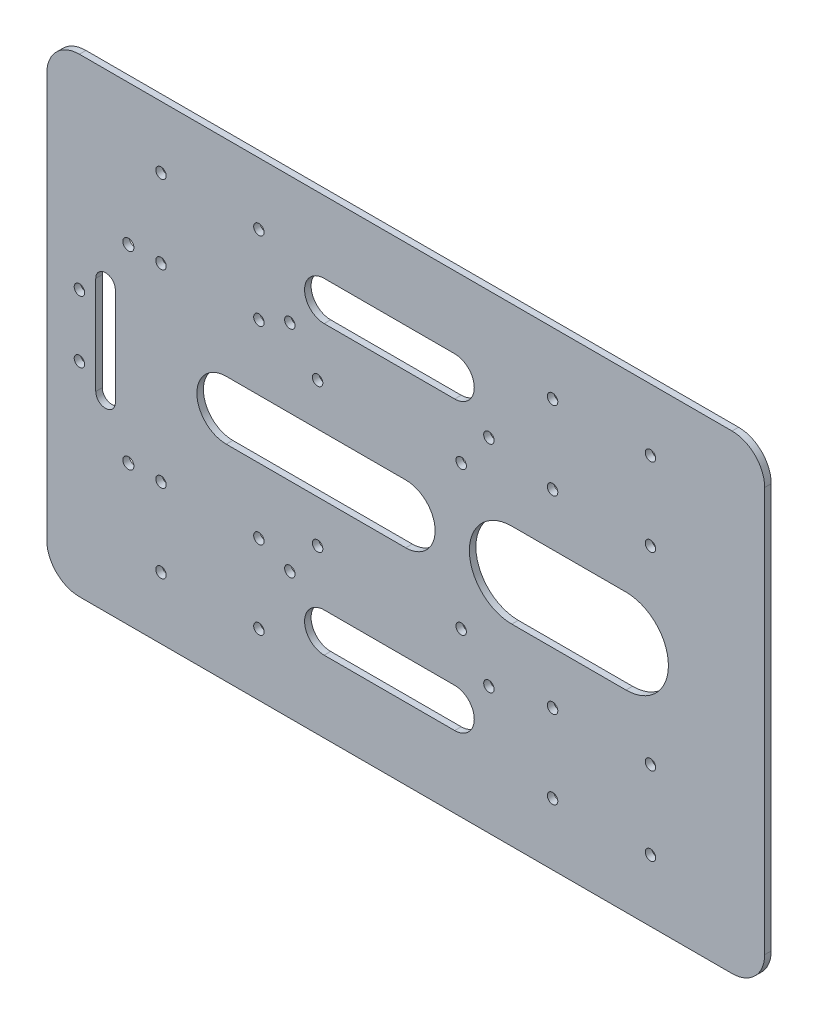
from build123d import *

# Parameters (mm, degrees)
SKETCH_1_W          = 220
SKETCH_1_H          = 144
SKETCH_1_R          = 1.6
SKETCH_1_R_2        = 1.6002032
EXTRUDE_1_DEPTH     = 2
CUT_EXTRUDE_1_DEPTH = 10
FILLET_1_R          = 10
CUT_EXTRUDE_2_DEPTH = 10
CUT_EXTRUDE_3_DEPTH = 10
SKETCH_8_R          = 1.6
CUT_EXTRUDE_4_DEPTH = 10
SKETCH_9_R          = 1.7
CUT_EXTRUDE_5_DEPTH = 10


with BuildPart() as part:
    # 草图1 → 凸台-拉伸1 (new body)
    with BuildSketch(Plane.XY):
        with Locations((60, -41.5)):
            Rectangle(SKETCH_1_W, SKETCH_1_H)
        with Locations((135, 11.5)):
            Circle(SKETCH_1_R, mode=Mode.SUBTRACT)
        with Locations((135, -12.5)):
            Circle(SKETCH_1_R, mode=Mode.SUBTRACT)
        with Locations((105, 11.5)):
            Circle(SKETCH_1_R, mode=Mode.SUBTRACT)
        with Locations((105, -12.5)):
            Circle(SKETCH_1_R, mode=Mode.SUBTRACT)
        with Locations((135, -70.5)):
            Circle(SKETCH_1_R, mode=Mode.SUBTRACT)
        with Locations((135, -94.5)):
            Circle(SKETCH_1_R, mode=Mode.SUBTRACT)
        with Locations((105, -70.5)):
            Circle(SKETCH_1_R, mode=Mode.SUBTRACT)
        with Locations((105, -94.5)):
            Circle(SKETCH_1_R, mode=Mode.SUBTRACT)
        with Locations((15, 11.5)):
            Circle(SKETCH_1_R, mode=Mode.SUBTRACT)
        with Locations((-15, 11.5)):
            Circle(SKETCH_1_R, mode=Mode.SUBTRACT)
        with Locations((15, -12.5)):
            Circle(SKETCH_1_R, mode=Mode.SUBTRACT)
        with Locations((-15, -12.5)):
            Circle(SKETCH_1_R, mode=Mode.SUBTRACT)
        with Locations((15, -70.5)):
            Circle(SKETCH_1_R, mode=Mode.SUBTRACT)
        with Locations((-15, -70.5)):
            Circle(SKETCH_1_R, mode=Mode.SUBTRACT)
        with Locations((15, -94.5)):
            Circle(SKETCH_1_R, mode=Mode.SUBTRACT)
        with Locations((-15, -94.5)):
            Circle(SKETCH_1_R, mode=Mode.SUBTRACT)
        with Locations((24.487307595, -8.49993523)):
            Circle(SKETCH_1_R_2, mode=Mode.SUBTRACT)
        with Locations((85.487429515, -8.49993523)):
            Circle(SKETCH_1_R_2, mode=Mode.SUBTRACT)
        with Locations((24.487307595, -74.50006731)):
            Circle(SKETCH_1_R, mode=Mode.SUBTRACT)
        with Locations((85.487429515, -74.50006731)):
            Circle(SKETCH_1_R_2, mode=Mode.SUBTRACT)
        with Locations((76.987299975, -19.5000762)):
            Circle(SKETCH_1_R, mode=Mode.SUBTRACT)
        with Locations((76.987299975, -63.5000762)):
            Circle(SKETCH_1_R, mode=Mode.SUBTRACT)
        with Locations((32.987299975, -63.5000762)):
            Circle(SKETCH_1_R, mode=Mode.SUBTRACT)
        with Locations((32.987299975, -19.5000762)):
            Circle(SKETCH_1_R, mode=Mode.SUBTRACT)
    extrude(amount=EXTRUDE_1_DEPTH)

    # 草图4 → 切除-拉伸1 (cut)
    with BuildSketch(Plane.XY.offset(2)):
        with BuildLine():
            Line((92.5, -28.5), (127.5, -28.5))
            ThreePointArc((127.5, -28.5), (140.5, -41.5), (127.5, -54.5))
            Line((127.5, -54.5), (92.5, -54.5))
            ThreePointArc((92.5, -54.5), (79.5, -41.5), (92.5, -28.5))
        make_face()
    extrude(amount=-CUT_EXTRUDE_1_DEPTH, mode=Mode.SUBTRACT)

    # 圆角1
    fillet_1_edges = [part.edges().sort_by_distance(p)[0] for p in [
        (-50, -113.5, 1),
        (-50, 30.5, 1),
        (170, 30.5, 1),
        (170, -113.5, 1),
    ]]
    fillet(fillet_1_edges, radius=FILLET_1_R)

    # 草图5 → 切除-拉伸2 (cut)
    with BuildSketch(Plane.XY.offset(2)):
        with BuildLine():
            Line((5, -32.5), (60, -32.5))
            ThreePointArc((60, -32.5), (69, -41.5), (60, -50.5))
            Line((60, -50.5), (5, -50.5))
            ThreePointArc((5, -50.5), (-4, -41.5), (5, -32.5))
        make_face()
    extrude(amount=-CUT_EXTRUDE_2_DEPTH, mode=Mode.SUBTRACT)

    # 草图6 → 切除-拉伸3 (cut)
    with BuildSketch(Plane.XY.offset(2)):
        with BuildLine():
            Line((35, 8.5), (75, 8.5))
            ThreePointArc((75, 8.5), (81, 2.5), (75, -3.5))
            Line((75, -3.5), (35, -3.5))
            ThreePointArc((35, -3.5), (29, 2.5), (35, 8.5))
        make_face()
        with BuildLine():
            Line((35, -91.5), (75, -91.5))
            ThreePointArc((75, -91.5), (81, -85.5), (75, -79.5))
            Line((75, -79.5), (35, -79.5))
            ThreePointArc((35, -79.5), (29, -85.5), (35, -91.5))
        make_face()
    extrude(amount=-CUT_EXTRUDE_3_DEPTH, mode=Mode.SUBTRACT)

    # 草图8 → 切除-拉伸4 (cut)
    with BuildSketch(Plane.XY.offset(2)):
        with Locations((-40, -32)):
            Circle(SKETCH_8_R)
        with Locations((-40, -51)):
            Circle(SKETCH_8_R)
        with BuildLine():
            Line((-29, -26.5), (-29, -56.5))
            ThreePointArc((-29, -56.5), (-32, -59.5), (-35, -56.5))
            Line((-35, -56.5), (-35, -26.5))
            ThreePointArc((-35, -26.5), (-32, -23.5), (-29, -26.5))
        make_face()
    extrude(amount=-CUT_EXTRUDE_4_DEPTH, mode=Mode.SUBTRACT)

    # 草图9 → 切除-拉伸5 (cut)
    with BuildSketch(Plane.XY.offset(2)):
        with Locations((-25, -70.5)):
            Circle(SKETCH_9_R)
        with Locations((-25, -12.5)):
            Circle(SKETCH_9_R)
    extrude(amount=-CUT_EXTRUDE_5_DEPTH, mode=Mode.SUBTRACT)


solid = part.part
